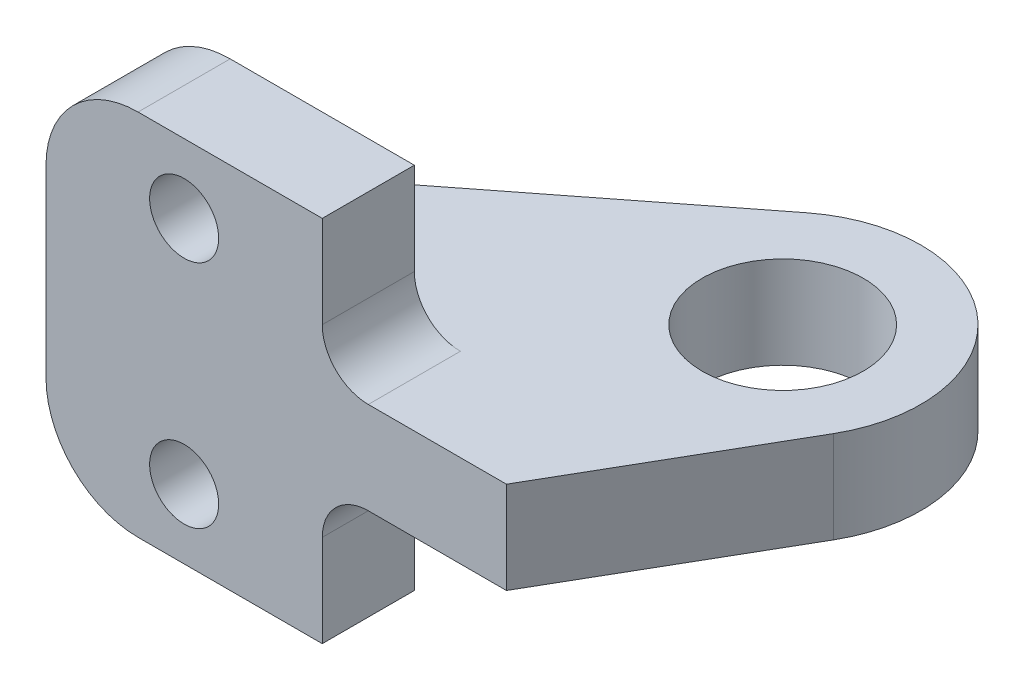
from build123d import *

# Parameters (mm, degrees)
SKETCH1_R           = 38.1
SKETCH1_R_2         = 22.225
BOSS_EXTRUDE1_DEPTH = 12.7
SKETCH2_W           = 101.6
SKETCH2_H           = 25.4
BOSS_EXTRUDE2_DEPTH = 38.1
SKETCH3_R           = 12.7
CUT_EXTRUDE1_DEPTH  = 195.272643468
SKETCH4_R           = 9.525
CUT_EXTRUDE3_DEPTH  = 38.1
FILLET3_R           = 25.4
SKETCH6_W           = 101.6
SKETCH6_H           = 25.4
BOSS_EXTRUDE3_DEPTH = 38.1
SKETCH7_R           = 12.7
CUT_EXTRUDE4_DEPTH  = 195.272643468
SKETCH8_R           = 9.525
CUT_EXTRUDE5_DEPTH  = 195.272643468
FILLET4_R           = 25.4


with BuildPart() as part:
    # Sketch1 → Boss-Extrude1 (new, symmetric)
    # profile 1 of 2: a face of its own
    with BuildSketch(Plane(origin=(0, 0, 0), x_dir=(1, 0, 0), z_dir=(0, 1, 0))):
        with BuildLine():
            Line((0, 25.4), (0, 0))
            Line((0, 0), (127, 0))
            Line((127, 0), (159.995567884, 57.15))
            ThreePointArc((159.995567884, 57.15), (101.997796947, 47.451089716), (103.55657019, 106.233574525))
            Line((103.55657019, 106.233574525), (0, 25.4))
        make_face()
    # profile 2 of 2: a face of its own
    with BuildSketch(Plane(origin=(0, 0, 0), x_dir=(1, 0, 0), z_dir=(0, 1, 0))):
        with Locations((127, 76.2)):
            Circle(SKETCH1_R)
        with Locations(Location((127, 76.2, 0), (0, 0, 270))):
            Circle(SKETCH1_R_2, mode=Mode.SUBTRACT)
    extrude(amount=BOSS_EXTRUDE1_DEPTH, both=True)

    # Sketch2 → Boss-Extrude2 (add)
    with BuildSketch(Plane(origin=(0, 12.7, 0), x_dir=(1, 0, 0), z_dir=(0, 1, 0))):
        with Locations((50.8, 12.7)):
            Rectangle(SKETCH2_W, SKETCH2_H)
    extrude(amount=BOSS_EXTRUDE2_DEPTH)

    # Sketch3 → Cut-Extrude1 (cut, through all)
    with BuildSketch(Plane(origin=(0, 0, -25.4), x_dir=(-1, 0, 0), z_dir=(0, 0, -1))):
        with BuildLine():
            ThreePointArc((-101.6, 25.4), (-88.9, 38.1), (-76.2, 25.4))
            Line((-76.2, 25.4), (-76.2, 50.8))
            Line((-76.2, 50.8), (-101.6, 50.8))
            Line((-101.6, 50.8), (-101.6, 25.4))
        make_face()
        with Locations((-88.9, 25.4)):
            Circle(SKETCH3_R)
        with BuildLine():
            Line((-101.6, 12.7), (-88.9, 12.7))
            ThreePointArc((-88.9, 12.7), (-97.880256121, 16.419743879), (-101.6, 25.4))
            Line((-101.6, 25.4), (-101.6, 12.7))
        make_face()
    extrude(amount=-CUT_EXTRUDE1_DEPTH, mode=Mode.SUBTRACT)

    # Sketch4 → Cut-Extrude3 (cut)
    with BuildSketch(Plane(origin=(0, 0, -25.4), x_dir=(-1, 0, 0), z_dir=(0, 0, -1))):
        with Locations((-38.1, 31.75)):
            Circle(SKETCH4_R)
    extrude(amount=-CUT_EXTRUDE3_DEPTH, mode=Mode.SUBTRACT)

    # Fillet3
    fillet3_edges = [part.edges().sort_by_distance(p)[0] for p in [
        (0, 50.8, -12.7),
    ]]
    fillet(fillet3_edges, radius=FILLET3_R)

    # Sketch6 → Boss-Extrude3 (add)
    with BuildSketch(Plane.XZ.offset(12.7)):
        with Locations((50.8, -12.7)):
            Rectangle(SKETCH6_W, SKETCH6_H)
    extrude(amount=BOSS_EXTRUDE3_DEPTH)

    # Sketch7 → Cut-Extrude4 (cut, through all)
    with BuildSketch(Plane(origin=(0, 0, -25.4), x_dir=(-1, 0, 0), z_dir=(0, 0, -1))):
        with BuildLine():
            Line((-76.2, -50.8), (-76.2, -25.4))
            ThreePointArc((-76.2, -25.4), (-88.9, -38.1), (-101.6, -25.4))
            Line((-101.6, -25.4), (-101.6, -50.8))
            Line((-101.6, -50.8), (-76.2, -50.8))
        make_face()
        with Locations((-88.9, -25.4)):
            Circle(SKETCH7_R)
        with BuildLine():
            ThreePointArc((-101.6, -25.4), (-97.880256121, -16.419743879), (-88.9, -12.7))
            Line((-88.9, -12.7), (-101.6, -12.7))
            Line((-101.6, -12.7), (-101.6, -25.4))
        make_face()
    extrude(amount=-CUT_EXTRUDE4_DEPTH, mode=Mode.SUBTRACT)

    # Sketch8 → Cut-Extrude5 (cut, through all)
    with BuildSketch(Plane(origin=(0, 0, -25.4), x_dir=(-1, 0, 0), z_dir=(0, 0, -1))):
        with Locations((-38.1, -31.75)):
            Circle(SKETCH8_R)
    extrude(amount=-CUT_EXTRUDE5_DEPTH, mode=Mode.SUBTRACT)

    # Fillet4
    fillet4_edges = [part.edges().sort_by_distance(p)[0] for p in [
        (0, -50.8, -12.7),
    ]]
    fillet(fillet4_edges, radius=FILLET4_R)


solid = part.part
